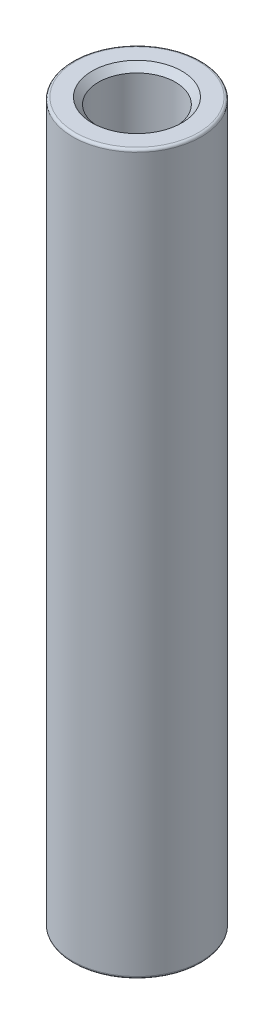
from build123d import *

# Parameters (mm, degrees)
SKETCH1_R           = 2.5
SKETCH1_R_2         = 1.5
BOSS_EXTRUDE1_DEPTH = 14
CHAMFER1_SIZE       = 0.25
FILLET1_R           = 0.1


with BuildPart() as part:
    # Sketch1 → Boss-Extrude1 (new, symmetric)
    with BuildSketch(Plane(origin=(0, 0, 0), x_dir=(1, 0, 0), z_dir=(0, 1, 0))):
        with Locations(Location((0, 0, 0), (0, 0, 270))):
            Circle(SKETCH1_R)
        with Locations(Location((0, 0, 0), (0, 0, 270))):
            Circle(SKETCH1_R_2, mode=Mode.SUBTRACT)
    extrude(amount=BOSS_EXTRUDE1_DEPTH, both=True)

    # Chamfer1
    chamfer1_edges = [part.edges().sort_by_distance(p)[0] for p in [
        (0, -14, -1.5),
        (0, 14, -1.5),
    ]]
    chamfer(chamfer1_edges, length=CHAMFER1_SIZE)

    # Fillet1
    fillet1_edges = [part.edges().sort_by_distance(p)[0] for p in [
        (0, -14, -2.5),
        (0, 14, -2.5),
    ]]
    fillet(fillet1_edges, radius=FILLET1_R)


solid = part.part
